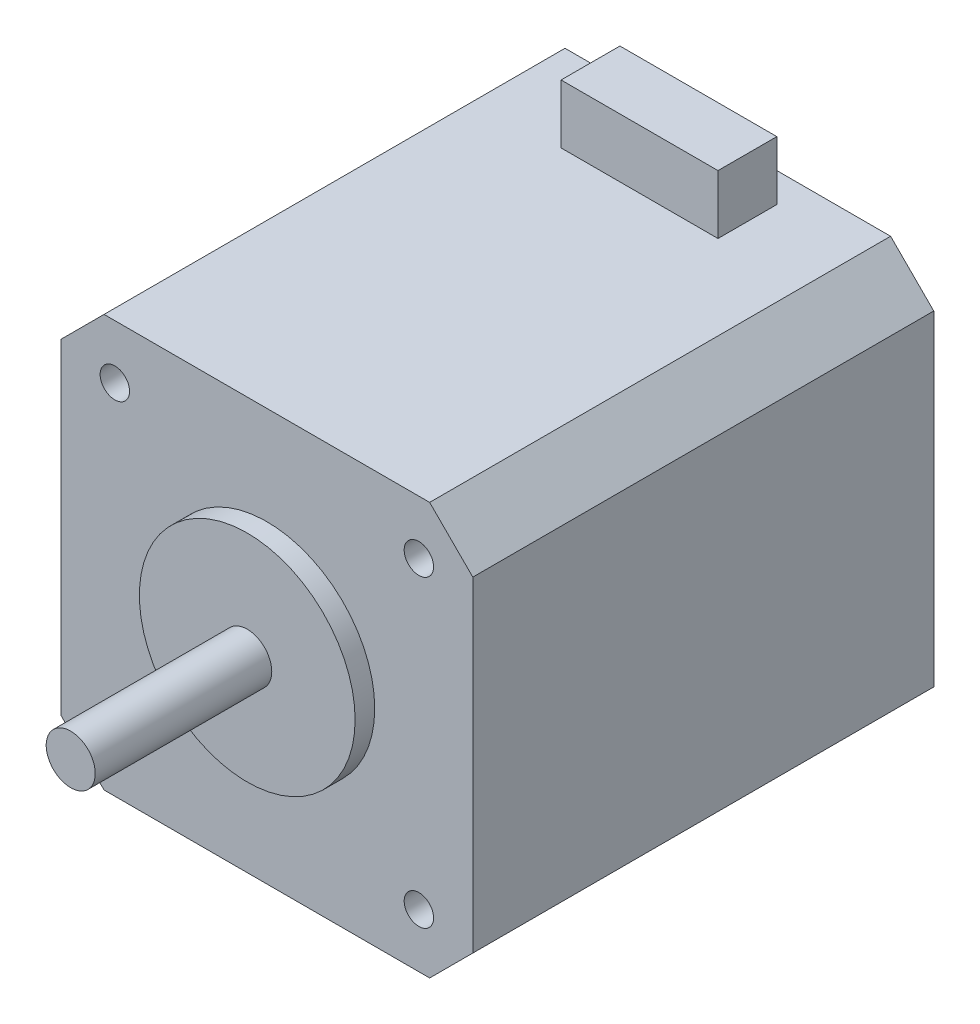
from build123d import *

# Parameters (mm, degrees)
SKETCH_1_R      = 1.5
EXTRUDE_1_DEPTH = 47
SKETCH_2_R      = 11
EXTRUDE_2_DEPTH = 2
SKETCH_3_R      = 2.5
EXTRUDE_3_DEPTH = 20
SKETCH_4_W      = 16
SKETCH_4_H      = 6
EXTRUDE_4_DEPTH = 6


with BuildPart() as part:
    # 草图1 → 凸台-拉伸1 (new body)
    with BuildSketch(Plane.XY):
        Polygon((21, 0), (21, 16.6), (16.6, 21), (0, 21), (-16.6, 21), (-21, 16.6), (-21, 0), (-21, -16.6), (-16.6, -21), (0, -21), (16.6, -21), (21, -16.6), align=None)
        with Locations((15.5, 15.5)):
            Circle(SKETCH_1_R, mode=Mode.SUBTRACT)
        with Locations((15.5, -15.5)):
            Circle(SKETCH_1_R, mode=Mode.SUBTRACT)
        with Locations((-15.5, -15.5)):
            Circle(SKETCH_1_R, mode=Mode.SUBTRACT)
        with Locations((-15.5, 15.5)):
            Circle(SKETCH_1_R, mode=Mode.SUBTRACT)
    extrude(amount=EXTRUDE_1_DEPTH)

    # 草图2 → 凸台-拉伸2 (add)
    with BuildSketch(Plane.XY.offset(47)):
        Circle(SKETCH_2_R)
    extrude(amount=EXTRUDE_2_DEPTH)

    # 草图3 → 凸台-拉伸3 (add)
    with BuildSketch(Plane.XY.offset(47)):
        Circle(SKETCH_3_R)
    extrude(amount=EXTRUDE_3_DEPTH)

    # 草图4 → 凸台-拉伸4 (add)
    with BuildSketch(Plane(origin=(0, 21, 0), x_dir=(1, 0, 0), z_dir=(0, 1, 0))):
        with Locations((0, -6)):
            Rectangle(SKETCH_4_W, SKETCH_4_H)
    extrude(amount=EXTRUDE_4_DEPTH)


solid = part.part
